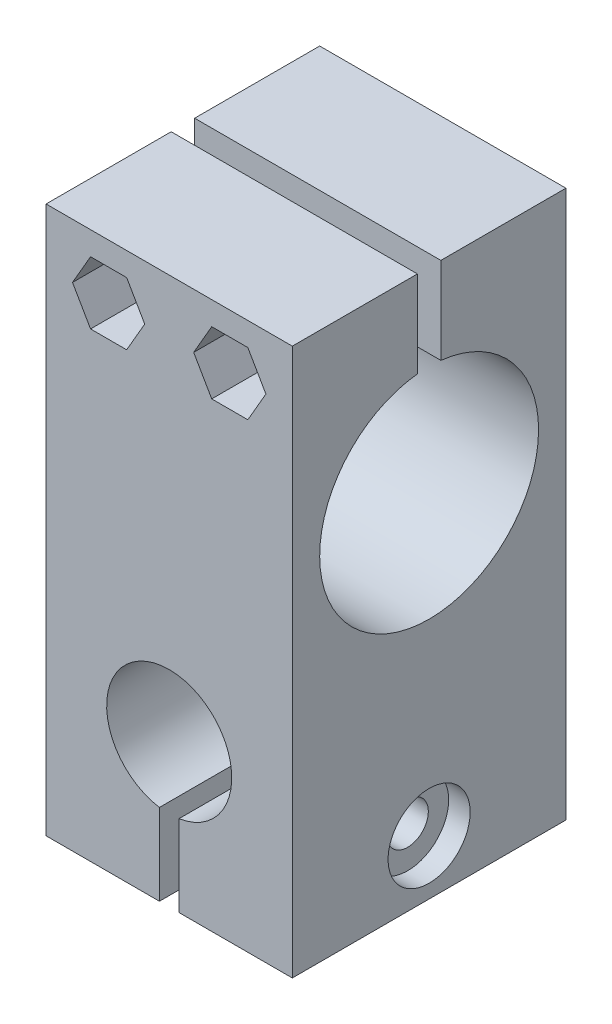
from build123d import *

# Parameters (mm, degrees)
BOSS_EXTRU_1_DEPTH                               = 35
BOSS_EXTRU_2_DEPTH                               = 31.5
CHAMBRAGE_POUR_VIS_T_TE_RONDE_6_PANS_D           = 5.3
CHAMBRAGE_POUR_VIS_T_TE_RONDE_6_PANS_DEPTH       = 44
CHAMBRAGE_POUR_VIS_T_TE_RONDE_6_PANS_CBORE_D     = 10.5
CHAMBRAGE_POUR_VIS_T_TE_RONDE_6_PANS_CBORE_DEPTH = 2.75
CHAMBRAGE_POUR_VIS_T_TE_RONDE_6_PANS_TIP         = 1.59228064
ENL_V_MAT_EXTRU_1_DEPTH                          = 8
ENL_V_MAT_EXTRU_2_DEPTH                          = 45
CHAMBRAGE_POUR_VIS_T_TE_RONDE_6_2_D              = 5.3
CHAMBRAGE_POUR_VIS_T_TE_RONDE_6_2_DEPTH          = 44
CHAMBRAGE_POUR_VIS_T_TE_RONDE_6_2_CBORE_D        = 10.5
CHAMBRAGE_POUR_VIS_T_TE_RONDE_6_2_CBORE_DEPTH    = 2.75
CHAMBRAGE_POUR_VIS_T_TE_RONDE_6_2_TIP            = 1.59228064
ENL_V_MAT_EXTRU_3_DEPTH                          = 6
ESQUISSE12_R                                     = 1.4
ENL_V_MAT_EXTRU_4_DEPTH                          = 5


with BuildPart() as part:
    # Esquisse1 → Boss.-Extru.1 (new body)
    with BuildSketch(Plane.XY):
        with BuildLine():
            Line((47.415392001, -544.601740315), (47.415392001, -555))
            Line((47.415392001, -555), (61.915392001, -555))
            Line((61.915392001, -555), (61.915392001, -505))
            Line((61.915392001, -505), (30.415392001, -505))
            Line((30.415392001, -505), (30.415392001, -555))
            Line((30.415392001, -555), (44.915392001, -555))
            Line((44.915392001, -555), (44.915392001, -544.601740315))
            ThreePointArc((44.915392001, -544.601740315), (46.165392001, -528.7), (47.415392001, -544.601740315))
        make_face()
    extrude(amount=-BOSS_EXTRU_1_DEPTH)

    # Esquisse4 → Boss.-Extru.2 (add)
    with BuildSketch(Plane(origin=(61.915392001, 0, 0), x_dir=(0, 0, -1), z_dir=(1, 0, 0))):
        Polygon((35, -505), (35, -485), (19.003014107, -485), (16.003014107, -485), (0, -485), (0, -505), align=None)
    extrude(amount=-BOSS_EXTRU_2_DEPTH)

    # Chambrage pour Vis _ t_te ronde _ 6 pans
    with Locations(Plane(origin=(0, 0, -35), x_dir=(-1, 0, 0), z_dir=(0, 0, -1))):
        with Locations((-53.915392001, -492), (-38.415392001, -492)):
            CounterBoreHole(CHAMBRAGE_POUR_VIS_T_TE_RONDE_6_PANS_D / 2, CHAMBRAGE_POUR_VIS_T_TE_RONDE_6_PANS_CBORE_D / 2, CHAMBRAGE_POUR_VIS_T_TE_RONDE_6_PANS_CBORE_DEPTH, depth=CHAMBRAGE_POUR_VIS_T_TE_RONDE_6_PANS_DEPTH)
            with Locations((0, 0, -(CHAMBRAGE_POUR_VIS_T_TE_RONDE_6_PANS_DEPTH + CHAMBRAGE_POUR_VIS_T_TE_RONDE_6_PANS_TIP / 2))):  # 118° drill point
                Cone(0, CHAMBRAGE_POUR_VIS_T_TE_RONDE_6_PANS_D / 2, CHAMBRAGE_POUR_VIS_T_TE_RONDE_6_PANS_TIP, mode=Mode.SUBTRACT)

    # Esquisse7 → Enlèv. mat.-Extru.1 (cut)
    with BuildSketch(Plane.XY):
        Polygon((56.224793078, -488), (51.605990924, -488), (49.296589847, -492), (51.605990924, -496), (56.224793078, -496), (58.534194154, -492), align=None)
        Polygon((40.724793078, -488), (36.105990924, -488), (33.796589847, -492), (36.105990924, -496), (40.724793078, -496), (43.034194154, -492), align=None)
    extrude(amount=-ENL_V_MAT_EXTRU_1_DEPTH, mode=Mode.SUBTRACT)

    # Esquisse8 → Enlèv. mat.-Extru.2 (cut)
    with BuildSketch(Plane(origin=(61.915392001, 0, 0), x_dir=(0, 0, -1), z_dir=(1, 0, 0))):
        with BuildLine():
            Line((16.003014107, -485), (16.003014107, -496.080264613))
            ThreePointArc((16.003014107, -496.080264613), (17.496968442, -523.999999672), (19.003014107, -496.080914233))
            Line((19.003014107, -496.080914233), (19.003014107, -485))
            Line((19.003014107, -485), (16.003014107, -485))
        make_face()
    extrude(amount=-ENL_V_MAT_EXTRU_2_DEPTH, mode=Mode.SUBTRACT)

    # Chambrage pour Vis _ t_te ronde _ 6  2
    with Locations(Plane(origin=(61.915392001, 0, 0), x_dir=(0, 0, -1), z_dir=(1, 0, 0))):
        with Locations((17.5, -548)):
            CounterBoreHole(CHAMBRAGE_POUR_VIS_T_TE_RONDE_6_2_D / 2, CHAMBRAGE_POUR_VIS_T_TE_RONDE_6_2_CBORE_D / 2, CHAMBRAGE_POUR_VIS_T_TE_RONDE_6_2_CBORE_DEPTH, depth=CHAMBRAGE_POUR_VIS_T_TE_RONDE_6_2_DEPTH)
            with Locations((0, 0, -(CHAMBRAGE_POUR_VIS_T_TE_RONDE_6_2_DEPTH + CHAMBRAGE_POUR_VIS_T_TE_RONDE_6_2_TIP / 2))):  # 118° drill point
                Cone(0, CHAMBRAGE_POUR_VIS_T_TE_RONDE_6_2_D / 2, CHAMBRAGE_POUR_VIS_T_TE_RONDE_6_2_TIP, mode=Mode.SUBTRACT)

    # Esquisse11 → Enlèv. mat.-Extru.3 (cut)
    with BuildSketch(Plane.ZY.offset(-30.415392001)):
        Polygon((-15.190598923, -544), (-19.809401077, -544), (-22.118802154, -548), (-19.809401077, -552), (-15.190598923, -552), (-12.881197846, -548), align=None)
    extrude(amount=-ENL_V_MAT_EXTRU_3_DEPTH, mode=Mode.SUBTRACT)

    # Esquisse12 → Enlèv. mat.-Extru.4 (cut)
    with BuildSketch(Plane.XZ.offset(555)):
        with Locations(Location((56.915392001, -31, 0), (0, 0, 270))):
            Circle(ESQUISSE12_R)
    extrude(amount=-ENL_V_MAT_EXTRU_4_DEPTH, mode=Mode.SUBTRACT)


solid = part.part
